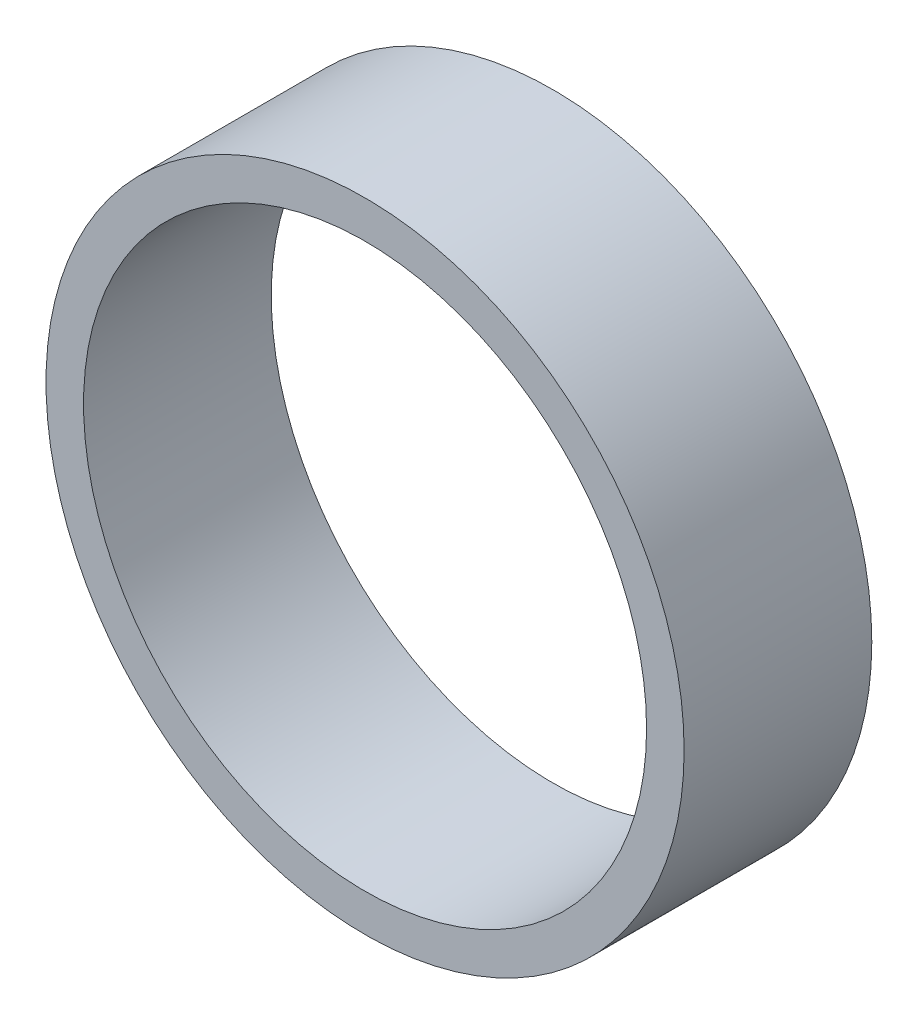
from build123d import *

# Parameters (mm, degrees)
SKETCH1_R           = 17
SKETCH1_R_2         = 15
BOSS_EXTRUDE1_DEPTH = 10


with BuildPart() as part:
    # Sketch1 → Boss-Extrude1 (new body)
    with BuildSketch(Plane.XY):
        Circle(SKETCH1_R)
        Circle(SKETCH1_R_2, mode=Mode.SUBTRACT)
    extrude(amount=BOSS_EXTRUDE1_DEPTH)


solid = part.part
